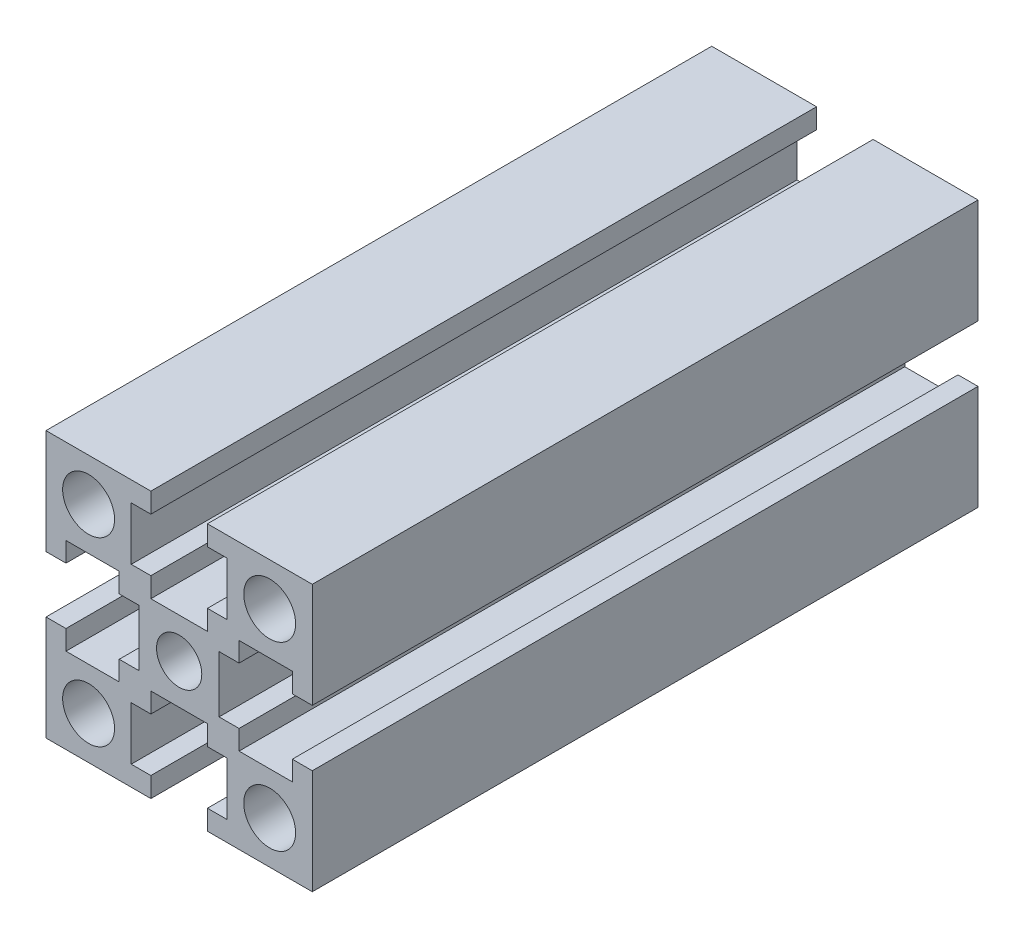
from build123d import *

# Parameters (mm, degrees)
SKETCH_1_R      = 3.9
SKETCH_1_R_2    = 3.4
EXTRUDE_1_DEPTH = 100


with BuildPart() as part:
    # 草图1 → 凸台-拉伸1 (new body)
    with BuildSketch(Plane.XY):
        Polygon((-5.338418149, 19.545792426), (-21.088418149, 19.545792426), (-21.088418149, 3.795792426), (-18.088418149, 3.795792426), (-18.088418149, 6.745792426), (-10.088418149, 6.745792426), (-10.088418149, 3.795792426), (-7.088418149, 3.795792426), (-7.088418149, -4.704207574), (-10.088418149, -4.704207574), (-10.088418149, -7.654207574), (-18.088418149, -7.654207574), (-18.088418149, -4.704207574), (-21.088418149, -4.704207574), (-21.088418149, -20.454207574), (-5.338418149, -20.454207574), (-5.338418149, -17.454207574), (-8.288418149, -17.454207574), (-8.288418149, -9.454207574), (-5.338418149, -9.454207574), (-5.338418149, -6.454207574), (3.161581851, -6.454207574), (3.161581851, -9.454207574), (6.111581851, -9.454207574), (6.111581851, -17.454207574), (3.161581851, -17.454207574), (3.161581851, -20.454207574), (18.911581851, -20.454207574), (18.911581851, -4.704207574), (15.911581851, -4.704207574), (15.911581851, -7.654207574), (7.911581851, -7.654207574), (7.911581851, -4.704207574), (4.911581851, -4.704207574), (4.911581851, 3.795792426), (7.911581851, 3.795792426), (7.911581851, 6.745792426), (15.911581851, 6.745792426), (15.911581851, 3.795792426), (18.911581851, 3.795792426), (18.911581851, 19.545792426), (3.161581851, 19.545792426), (3.161581851, 16.545792426), (6.111581851, 16.545792426), (6.111581851, 8.545792426), (3.161581851, 8.545792426), (3.161581851, 5.545792426), (-5.338418149, 5.545792426), (-5.338418149, 8.545792426), (-8.288418149, 8.545792426), (-8.288418149, 16.545792426), (-5.338418149, 16.545792426), align=None)
        with Locations((-14.688418149, 13.145792426)):
            Circle(SKETCH_1_R, mode=Mode.SUBTRACT)
        with Locations((12.511581851, 13.145792426)):
            Circle(SKETCH_1_R, mode=Mode.SUBTRACT)
        with Locations((-14.688418149, -14.054207574)):
            Circle(SKETCH_1_R, mode=Mode.SUBTRACT)
        with Locations((12.511581851, -14.054207574)):
            Circle(SKETCH_1_R, mode=Mode.SUBTRACT)
        with Locations((-1.088418149, -0.454207574)):
            Circle(SKETCH_1_R_2, mode=Mode.SUBTRACT)
    extrude(amount=EXTRUDE_1_DEPTH)


solid = part.part
